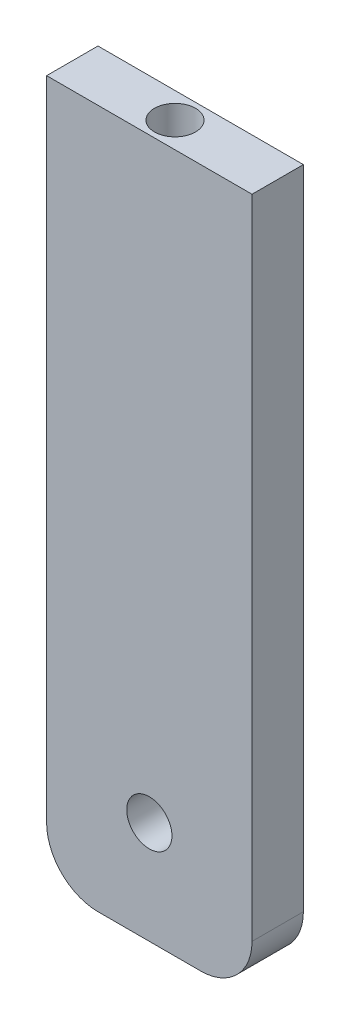
from build123d import *

# Parameters (mm, degrees)
SKETCH_1_W          = 20
SKETCH_1_H          = 68
SKETCH_1_R          = 2.2
EXTRUDE_1_DEPTH     = 5
FILLET_1_R          = 5
SKETCH_2_R          = 2
CUT_EXTRUDE_1_DEPTH = 10


with BuildPart() as part:
    # ｽｹｯﾁ1 → ﾎﾞｽ - 押し出し1 (new body)
    with BuildSketch(Plane.XY):
        with Locations((10, 34)):
            Rectangle(SKETCH_1_W, SKETCH_1_H)
        with Locations((10, 10)):
            Circle(SKETCH_1_R, mode=Mode.SUBTRACT)
    extrude(amount=EXTRUDE_1_DEPTH)

    # ﾌｨﾚｯﾄ1
    fillet_1_edges = [part.edges().sort_by_distance(p)[0] for p in [
        (20, 0, 2.5),
        (0, 0, 2.5),
    ]]
    fillet(fillet_1_edges, radius=FILLET_1_R)

    # ｽｹｯﾁ2 → ｶｯﾄ - 押し出し1 (cut)
    with BuildSketch(Plane(origin=(0, 68, 0), x_dir=(1, 0, 0), z_dir=(0, 1, 0))):
        with Locations(Location((10, -2.5, 0), (0, 0, 270))):
            Circle(SKETCH_2_R)
    extrude(amount=-CUT_EXTRUDE_1_DEPTH, mode=Mode.SUBTRACT)


solid = part.part
